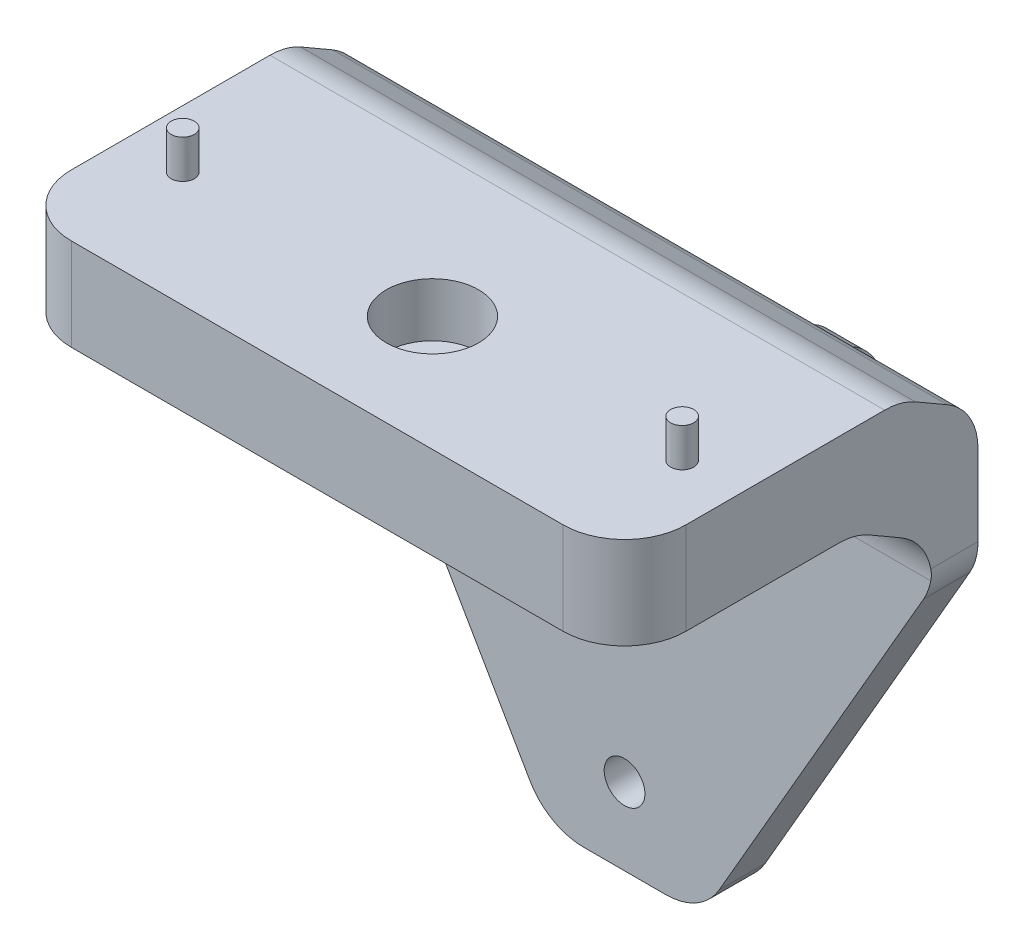
from build123d import *
from OCP.BRepFilletAPI import BRepFilletAPI_MakeChamfer

# Parameters (mm, degrees)
BOSS_EXTRUDE1_DEPTH = 40
SKETCH2_R           = 2.65
CUT_EXTRUDE2_DEPTH  = 12
SKETCH3_R           = 6
CUT_EXTRUDE3_DEPTH  = 7
CUT_EXTRUDE4_REACH  = 86.67
SKETCH4_R           = 2.65
CHAMFER2_SIZE       = 30
CHAMFER2_SIZE2      = 51.961524227
SKETCH7_W           = 5
SKETCH7_H           = 40
BOSS_EXTRUDE3_DEPTH = 10
CHAMFER1_SIZE       = 10
CHAMFER1_SIZE2      = 5.773502692
FILLET1_R           = 8
FILLET2_R           = 8
SKETCH5_R           = 1.5
BOSS_EXTRUDE2_DEPTH = 5
FILLET3_R           = 8


with BuildPart() as part:
    # Sketch1 → Boss-Extrude1 (new, symmetric)
    with BuildSketch(Plane(origin=(0, 0, 0), x_dir=(0, 0, -1), z_dir=(1, 0, 0))):
        Polygon((0, 0), (40, 0), (40, -63), (46, -63), (46, 12), (0, 12), align=None)
    extrude(amount=BOSS_EXTRUDE1_DEPTH, both=True)

    # Sketch2 → Cut-Extrude2 (cut)
    with BuildSketch(Plane.XZ):
        with Locations(Location((0, -15, 0), (0, 0, 270))):
            Circle(SKETCH2_R)
    extrude(amount=-CUT_EXTRUDE2_DEPTH, mode=Mode.SUBTRACT)

    # Sketch3 → Cut-Extrude3 (cut)
    with BuildSketch(Plane(origin=(0, 12, 0), x_dir=(1, 0, 0), z_dir=(0, 1, 0))):
        with Locations(Location((0, 15, 0), (0, 0, 270))):
            Circle(SKETCH3_R)
    extrude(amount=-CUT_EXTRUDE3_DEPTH, mode=Mode.SUBTRACT)

    # Sketch4 → Cut-Extrude4 (cut, up to next)
    with BuildSketch(Plane.XY.offset(-40), mode=Mode.PRIVATE) as cut_extrude4_sk1:
        with Locations((0, -53)):
            Circle(SKETCH4_R)
    cut_extrude4_tool1 = extrude(cut_extrude4_sk1.sketch, amount=-CUT_EXTRUDE4_REACH, mode=Mode.PRIVATE) & part.part
    # Sketch4 → Cut-Extrude4 (cut, up to next)
    with BuildSketch(Plane.XY.offset(-40), mode=Mode.PRIVATE) as cut_extrude4_sk2:
        with Locations((0, -25)):
            Circle(SKETCH4_R)
    cut_extrude4_tool2 = extrude(cut_extrude4_sk2.sketch, amount=-CUT_EXTRUDE4_REACH, mode=Mode.PRIVATE) & part.part
    add(cut_extrude4_tool1.solids().sort_by_distance((0, -53, -40))[0], mode=Mode.SUBTRACT)
    add(cut_extrude4_tool2.solids().sort_by_distance((0, -25, -40))[0], mode=Mode.SUBTRACT)

    # Chamfer2
    chamfer2_edges = [part.edges().sort_by_distance(p)[0] for p in [
        (40, -63, -43),
        (-40, -63, -43),
    ]]
    chamfer2_side = [part.faces().sort_by_distance(p)[0] for p in [
        (0, -63, -43),
    ]]
    chamfer(chamfer2_edges, length=CHAMFER2_SIZE, length2=CHAMFER2_SIZE2, reference=chamfer2_side[0])

    # Sketch7 → Boss-Extrude3 (add)
    with BuildSketch(Plane(origin=(0, 0, -46), x_dir=(-1, 0, 0), z_dir=(0, 0, -1))):
        with Locations((-15.2, -20)):
            Rectangle(SKETCH7_W, SKETCH7_H)
    extrude(amount=BOSS_EXTRUDE3_DEPTH)

    # Chamfer1: one chamfer whose edges measure the first distance from different faces: ONE call of the kernel's chamfer builder (chamfer() names one face for all edges)
    chamfer1_edges_1 = [part.edges().sort_by_distance(p)[0] for p in [
        (0, 12, -46),
    ]]
    chamfer1_side_1 = [part.faces().sort_by_distance(p)[0] for p in [
        (0, 12, -23.253659483),
    ]]
    chamfer1_edges_2 = [part.edges().sort_by_distance(p)[0] for p in [
        (0, 0, -40),
    ]]
    chamfer1_side_2 = [part.faces().sort_by_distance(p)[0] for p in [
        (0, 0, -20.034710925),
    ]]
    chamfer1 = BRepFilletAPI_MakeChamfer(part.part.solid().wrapped)
    for e in chamfer1_edges_1:
        chamfer1.Add(CHAMFER1_SIZE, CHAMFER1_SIZE2, e.wrapped, chamfer1_side_1[0].wrapped)  # the first distance lies on this face
    for e in chamfer1_edges_2:
        chamfer1.Add(CHAMFER1_SIZE, CHAMFER1_SIZE2, e.wrapped, chamfer1_side_2[0].wrapped)  # the first distance lies on this face
    add(Compound.cast(chamfer1.Shape()), mode=Mode.REPLACE)

    # Fillet1
    fillet1_edges = [part.edges().sort_by_distance(p)[0] for p in [
        (0, 12, -36),
        (0, 6.226497308, -46),
        (0, -5.773502692, -40),
        (0, 0, -30),
    ]]
    fillet(fillet1_edges, radius=FILLET1_R)

    # Fillet2
    fillet2_edges = [part.edges().sort_by_distance(p)[0] for p in [
        (-40, 6, 0),
        (40, 6, 0),
        (-40, -11.038475773, -43),
        (40, -11.038475773, -43),
        (10, -63, -43),
        (-10, -63, -43),
    ]]
    fillet(fillet2_edges, radius=FILLET2_R)

    # Sketch5 → Boss-Extrude2 (add)
    with BuildSketch(Plane(origin=(0, 12, 0), x_dir=(1, 0, 0), z_dir=(0, 1, 0))):
        with Locations(Location((-32.5, 15, 0), (0, 0, 90))):
            Circle(SKETCH5_R)
        with Locations(Location((32.5, 15, 0), (0, 0, 90))):
            Circle(SKETCH5_R)
    extrude(amount=BOSS_EXTRUDE2_DEPTH)

    # Fillet3
    fillet3_edges = [part.edges().sort_by_distance(p)[0] for p in [
        (15.2, 0, -56),
        (15.2, -40, -56),
    ]]
    fillet(fillet3_edges, radius=FILLET3_R)


solid = part.part
